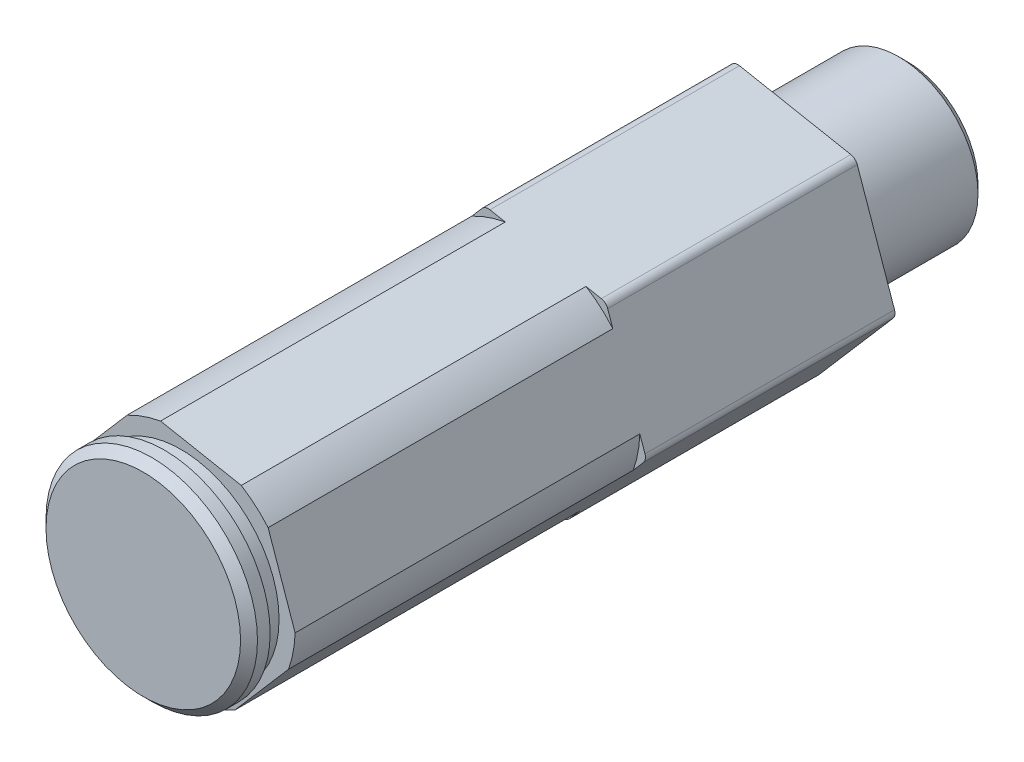
from build123d import *

# Parameters (mm, degrees)
SKETCH3_OUTSIDE_W   = 25.686
SKETCH3_OUTSIDE_H   = 25.686
CUT_EXTRUDE1_DEPTH  = 47.887731907
CHAMFER1_SIZE       = 0.508
BOSS_EXTRUDE1_DEPTH = 14.986
FILLET1_R           = 0.508


with BuildPart() as part:
    # Sketch2 → Revolve1 (revolve)
    with BuildSketch(Plane(origin=(0, 0, 0), x_dir=(0, 0, -1), z_dir=(1, 0, 0)), mode=Mode.PRIVATE) as revolve1_sk:
        Polygon((-22.9362, 0), (22.9362, 0), (22.9362, 4.7625), (15.0114, 4.7625), (15.0114, 6.862299966), (-20.6756, 6.862299966), (-20.6756, 5.8928), (-21.6662, 5.8928), (-21.6662, 6.35), (-22.9362, 6.35), align=None)
    revolve(revolve1_sk.sketch.rotate(Axis((0, 0, 22.9362), (0, 0, -1)), 90), axis=Axis((0, 0, 22.9362), (0, 0, -1)))

    # Sketch3 outside → Cut-Extrude1 (cut, through all)
    with BuildSketch(Plane.XY.offset(22.9362)):
        Rectangle(SKETCH3_OUTSIDE_W, SKETCH3_OUTSIDE_H)
        Polygon((7.26292966, -1.38571412), (4.83152846, 5.597024532), (-2.4314012, 6.982738652), (-7.26292966, 1.38571412), (-4.83152846, -5.597024532), (2.4314012, -6.982738652), align=None, mode=Mode.SUBTRACT)
    extrude(amount=-CUT_EXTRUDE1_DEPTH, mode=Mode.SUBTRACT)

    # Chamfer1
    chamfer1_edges = [part.edges().sort_by_distance(p)[0] for p in [
        (-4.7625, 0, -22.9362),
        (-6.35, 0, 22.9362),
    ]]
    chamfer(chamfer1_edges, length=CHAMFER1_SIZE)

    # Sketch4 → Boss-Extrude1 (add)
    with BuildSketch(Plane(origin=(0, 0, -15.0114), x_dir=(-1, 0, 0), z_dir=(0, 0, -1))):
        Polygon((-2.4314012, -6.982738652), (4.83152846, -5.597024532), (7.26292966, 1.38571412), (2.4314012, 6.982738652), (-4.83152846, 5.597024532), (-7.26292966, -1.38571412), align=None)
    extrude(amount=-BOSS_EXTRUDE1_DEPTH)

    # Fillet1
    fillet1_edges = [part.edges().sort_by_distance(p)[0] for p in [
        (2.4314012, -6.982738652, -7.5184),
        (-4.83152846, -5.597024532, -7.5184),
        (-7.26292966, 1.38571412, -7.5184),
        (-2.4314012, 6.982738652, -7.5184),
        (7.26292966, -1.38571412, -7.5184),
        (4.83152846, 5.597024532, -7.5184),
    ]]
    fillet(fillet1_edges, radius=FILLET1_R)


solid = part.part
